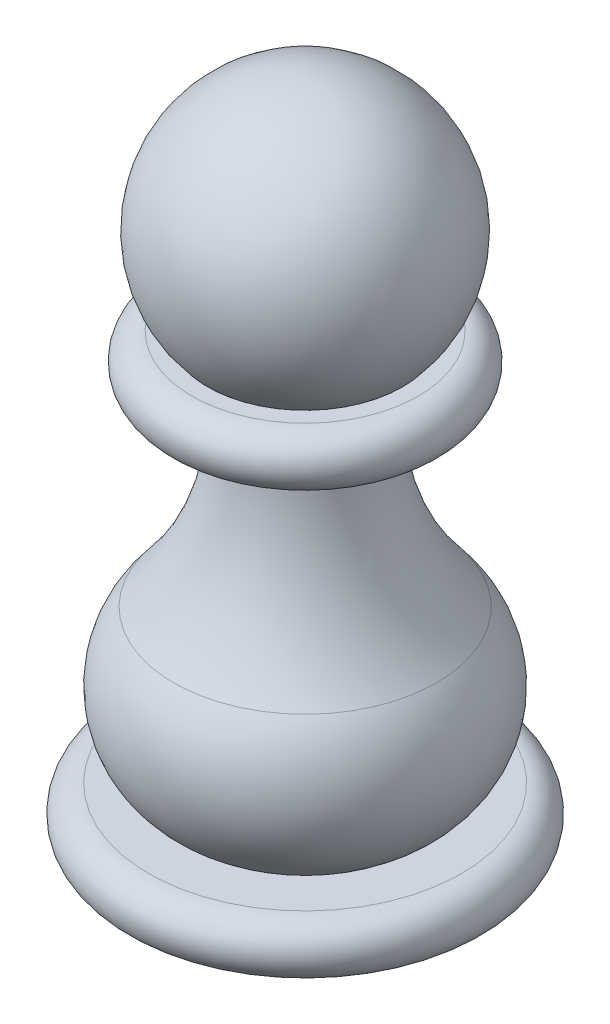
from build123d import *


with BuildPart() as part:
    # Sketch1 → Revolve1 (revolve)
    with BuildSketch(Plane.XY, mode=Mode.PRIVATE) as revolve1_sk:
        with BuildLine():
            Line((0, 0), (9, 0))
            ThreePointArc((9, 0), (10.5, 1.5), (9, 3))
            Line((9, 3), (6.5, 3))
            ThreePointArc((6.5, 3), (8.956479045, 7.152039153), (7.562140976, 11.770430623))
            ThreePointArc((7.562140976, 11.770430623), (4.731529648, 16.786775193), (4, 22.5))
            Line((4, 22.5), (6.5, 22.5))
            ThreePointArc((6.5, 22.5), (8, 24), (6.5, 25.5))
            Line((6.5, 25.5), (5.590169944, 25.5))
            ThreePointArc((5.590169944, 25.5), (6.846531969, 33.561862178), (0, 38))
            Line((0, 38), (0, 0))
        make_face()
    revolve(revolve1_sk.sketch.rotate(Axis((0, 0, 0), (0, 1, 0)), 90), axis=Axis((0, 0, 0), (0, 1, 0)))


solid = part.part
